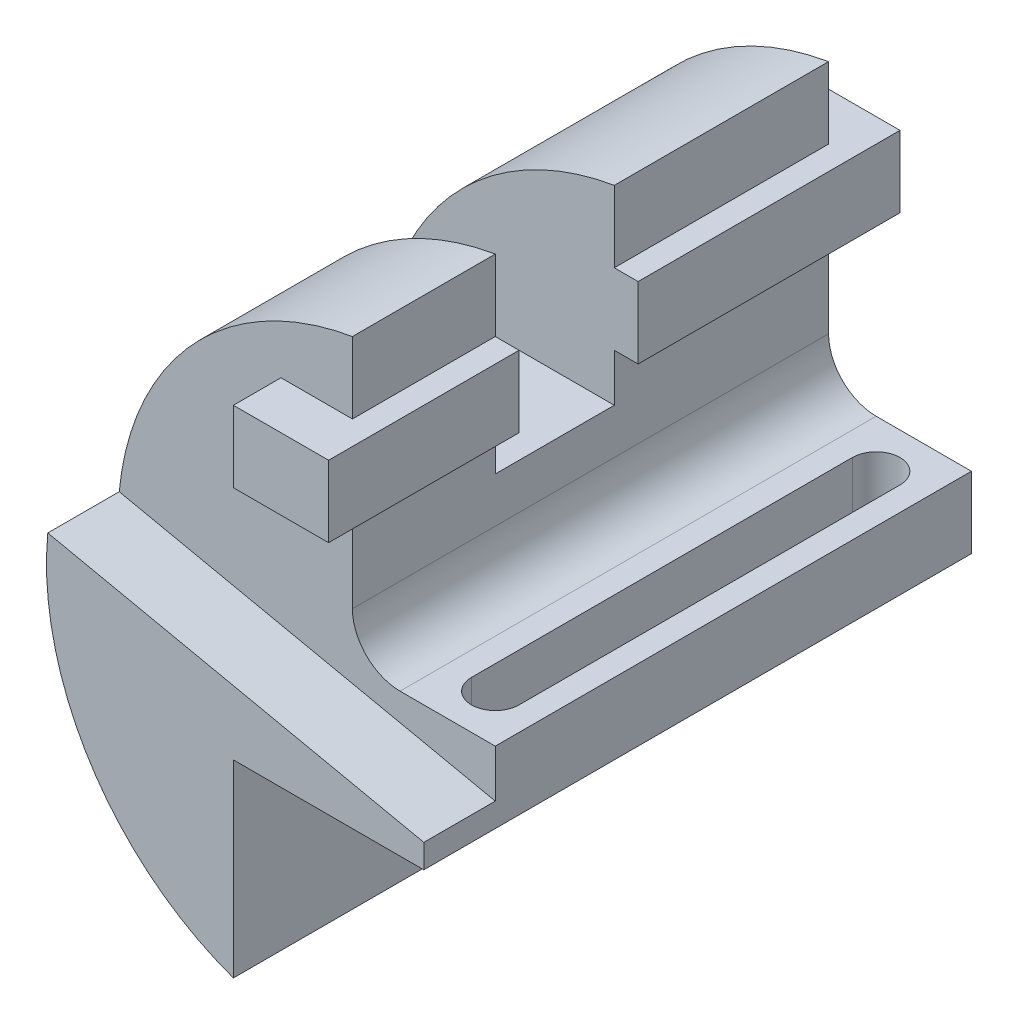
from build123d import *

# Parameters (mm, degrees)
BOSS_EXTRU_1_DEPTH      = 115
ENL_V_START             = -15
ENL_V_MAT_EXTRU_1_DEPTH = 15
BOSS_EXTRU_2_START      = -110
ESQUISSE3_W             = 20
ESQUISSE3_H             = 15
BOSS_EXTRU_2_DEPTH      = 120
ESQUISSE4_W             = 25
ESQUISSE4_H             = 40
ENL_V_MAT_EXTRU_2_DEPTH = 140.92363989
ENL_V_MAT_EXTRU_3_DEPTH = 143.393161704


with BuildPart() as part:
    # Esquisse1 → Boss.-Extru.1 (new body)
    with BuildSketch(Plane.XY):
        with BuildLine():
            Line((-10, 58.400021404), (-10, 8.900021404))
            ThreePointArc((-10, 8.900021404), (-7.071067812, 1.828953592), (0, -1.099978596))
            Line((0, -1.099978596), (20, -1.099978596))
            Line((20, -1.099978596), (20, -16.099978596))
            Line((20, -16.099978596), (-20, -16.099978596))
            Line((-20, -16.099978596), (-20, -55.772417018))
            ThreePointArc((-20, -55.772417018), (-59.024032595, 5.169726898), (-10, 58.400021404))
        make_face()
    extrude(amount=BOSS_EXTRU_1_DEPTH)

    # Esquisse2 → Enlèv. mat.-Extru.1 (cut)
    with BuildSketch(Plane.XY.offset(115).offset(ENL_V_START)):
        with BuildLine():
            Line((20, -11.099978596), (-58.976442171, 5.686982405))
            ThreePointArc((-58.976442171, 5.686982405), (-43.406261228, 40.329381178), (-10, 58.400021404))
            Line((-10, 58.400021404), (-10, 8.900021404))
            ThreePointArc((-10, 8.900021404), (-7.071067812, 1.828953592), (0, -1.099978596))
            Line((0, -1.099978596), (20, -1.099978596))
            Line((20, -1.099978596), (20, -11.099978596))
        make_face()
    extrude(amount=ENL_V_MAT_EXTRU_1_DEPTH, mode=Mode.SUBTRACT)

    # Esquisse3 → Boss.-Extru.2 (add)
    with BuildSketch(Plane.XY.offset(100).offset(BOSS_EXTRU_2_START)):
        with Locations((-15, 35.900021404)):
            Rectangle(ESQUISSE3_W, ESQUISSE3_H)
    extrude(amount=BOSS_EXTRU_2_DEPTH)

    # Esquisse4 → Enlèv. mat.-Extru.2 (cut, through all)
    with BuildSketch(Plane(origin=(-5, 0, 0), x_dir=(0, 0, -1), z_dir=(1, 0, 0))):
        with Locations((-57.5, 38.400021404)):
            Rectangle(ESQUISSE4_W, ESQUISSE4_H)
    extrude(amount=-ENL_V_MAT_EXTRU_2_DEPTH, mode=Mode.SUBTRACT)

    # Esquisse5 → Enlèv. mat.-Extru.3 (cut, through all)
    with BuildSketch(Plane(origin=(0, -1.099978596, 0), x_dir=(1, 0, 0), z_dir=(0, 1, 0))):
        with BuildLine():
            Line((15, -10), (15, -90))
            ThreePointArc((15, -90), (10, -95), (5, -90))
            Line((5, -90), (5, -10))
            ThreePointArc((5, -10), (10, -5), (15, -10))
        make_face()
    extrude(amount=-ENL_V_MAT_EXTRU_3_DEPTH, mode=Mode.SUBTRACT)


solid = part.part
